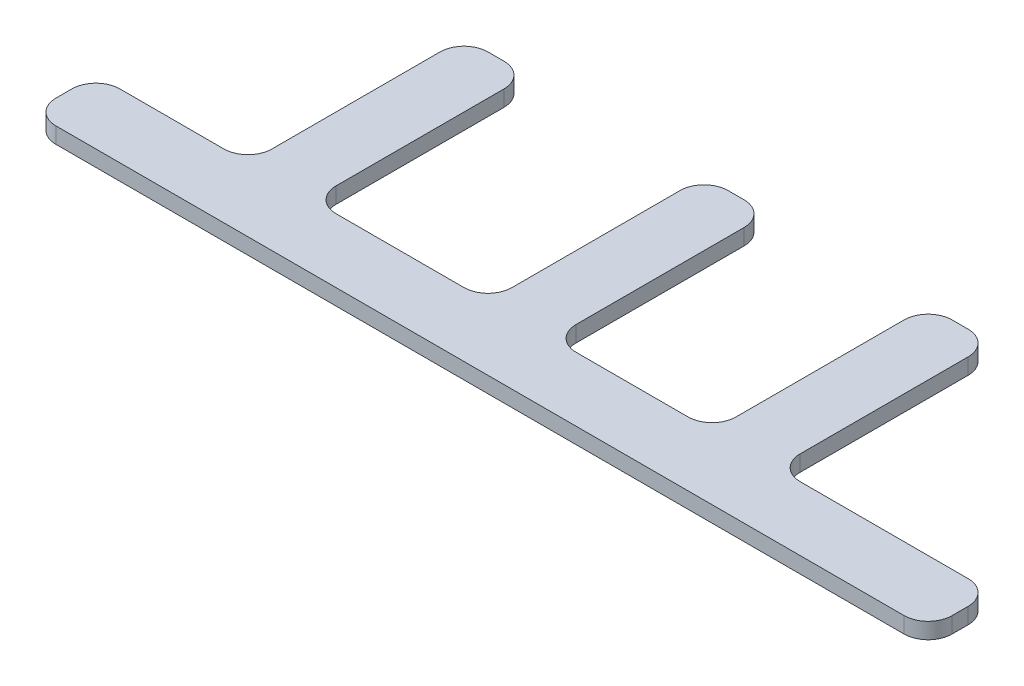
from build123d import *

# Parameters (mm, degrees)
BOSS_EXTRUDE1_DEPTH = 2


with BuildPart() as part:
    # Sketch1 → Boss-Extrude1 (new body)
    with BuildSketch(Plane(origin=(0, 0, 0), x_dir=(1, 0, 0), z_dir=(0, 1, 0))):
        with BuildLine():
            Line((-20, 4), (-4, 4))
            ThreePointArc((-4, 4), (-1.878679656, 4.878679656), (-1, 7))
            Line((-1, 7), (-1, 28))
            ThreePointArc((-1, 28), (-0.121320344, 30.121320344), (2, 31))
            Line((2, 31), (4, 31))
            ThreePointArc((4, 31), (6.121320344, 30.121320344), (7, 28))
            Line((7, 28), (7, 7))
            ThreePointArc((7, 7), (7.878679656, 4.878679656), (10, 4))
            Line((10, 4), (24, 4))
            ThreePointArc((24, 4), (26.121320344, 4.878679656), (27, 7))
            Line((27, 7), (27, 28))
            ThreePointArc((27, 28), (27.878679656, 30.121320344), (30, 31))
            Line((30, 31), (32, 31))
            ThreePointArc((32, 31), (34.121320344, 30.121320344), (35, 28))
            Line((35, 28), (35, 7))
            ThreePointArc((35, 7), (35.878679656, 4.878679656), (38, 4))
            Line((38, 4), (59, 4))
            ThreePointArc((59, 4), (61.121320344, 3.121320344), (62, 1))
            Line((62, 1), (62, -1))
            ThreePointArc((62, -1), (61.121320344, -3.121320344), (59, -4))
            Line((59, -4), (-47, -4))
            ThreePointArc((-47, -4), (-49.121320344, -3.121320344), (-50, -1))
            Line((-50, -1), (-50, 1))
            ThreePointArc((-50, 1), (-49.121320344, 3.121320344), (-47, 4))
            Line((-47, 4), (-34, 4))
            ThreePointArc((-34, 4), (-31.878679656, 4.878679656), (-31, 7))
            Line((-31, 7), (-31, 28))
            ThreePointArc((-31, 28), (-30.121320344, 30.121320344), (-28, 31))
            Line((-28, 31), (-26, 31))
            ThreePointArc((-26, 31), (-23.878679656, 30.121320344), (-23, 28))
            Line((-23, 28), (-23, 7))
            ThreePointArc((-23, 7), (-22.121320344, 4.878679656), (-20, 4))
        make_face()
    extrude(amount=BOSS_EXTRUDE1_DEPTH)


solid = part.part
